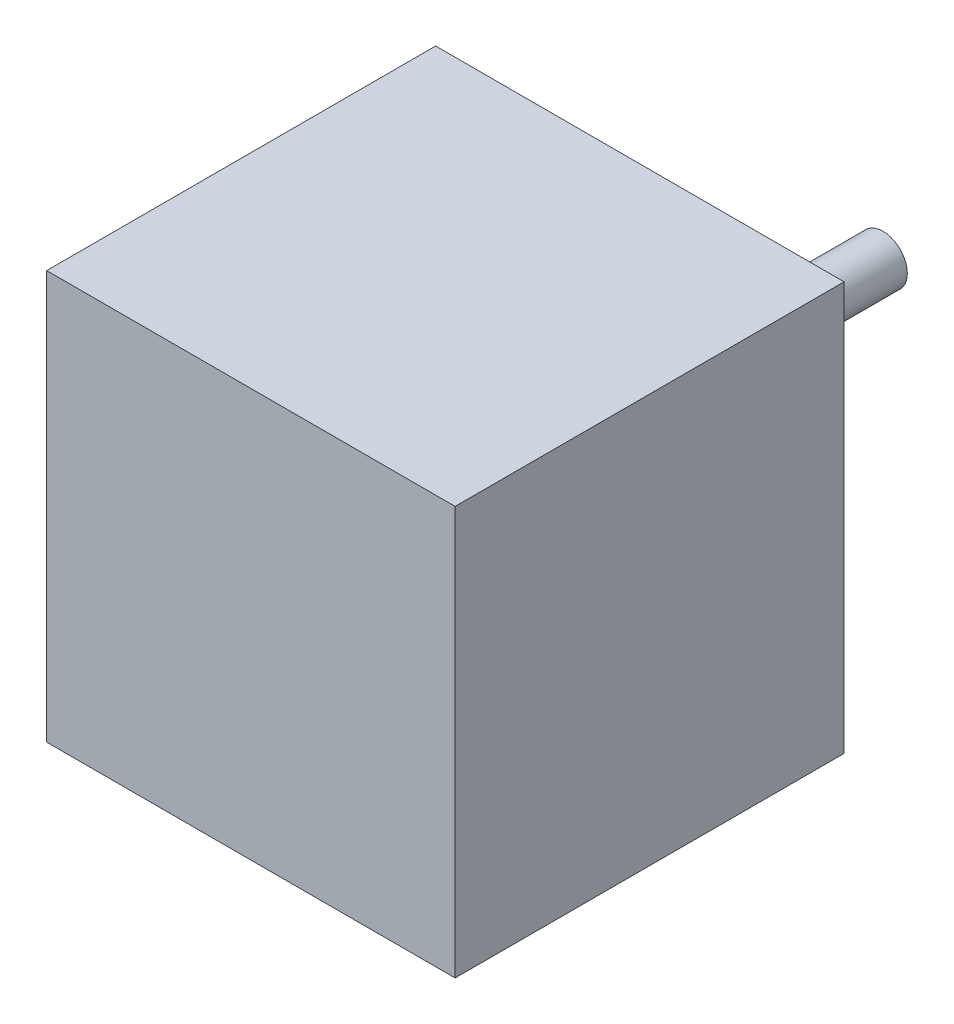
from build123d import *

# Parameters (mm, degrees)
SKETCH_1_W      = 42
SKETCH_1_H      = 42
EXTRUDE_1_DEPTH = 40
SKETCH_1_3_R    = 11.5
EXTRUDE_2_DEPTH = 2
SKETCH_1_4_R    = 2.5
EXTRUDE_3_DEPTH = 25


with BuildPart() as part:
    # 草图1 → 凸台-拉伸1 (new body)
    with BuildSketch(Plane.XY):
        Rectangle(SKETCH_1_W, SKETCH_1_H)
    extrude(amount=EXTRUDE_1_DEPTH)

    # 草图1<3> → 凸台-拉伸2 (add)
    with BuildSketch(Plane.XY):
        Circle(SKETCH_1_3_R)
    extrude(amount=-EXTRUDE_2_DEPTH)

    # 草图1<4> → 凸台-拉伸3 (add)
    with BuildSketch(Plane.XY):
        Circle(SKETCH_1_4_R)
    extrude(amount=-EXTRUDE_3_DEPTH)


solid = part.part
